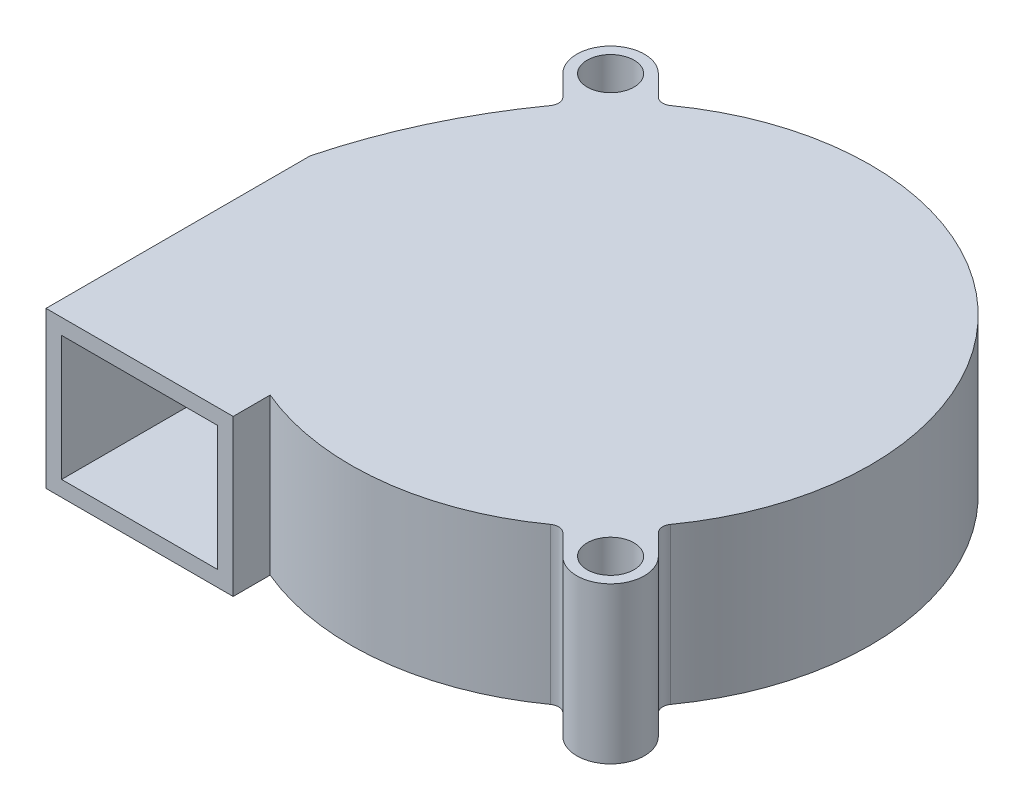
from build123d import *

# Parameters (mm, degrees)
SKETCH1_R            = 2.25
BOSS_EXTRUDE1_DEPTH  = 15
SKETCH2_W            = 15
SKETCH2_H            = 12
BLOWER_OPENING_DEPTH = 20


with BuildPart() as part:
    # Sketch1 → Boss-Extrude1 (new body)
    with BuildSketch(Plane(origin=(0, 0, 0), x_dir=(1, 0, 0), z_dir=(0, 1, 0))):
        with BuildLine():
            ThreePointArc((-20.329518762, 14.550280647), (-24.739386117, 7.014235726), (-27.7, -1.2))
            Line((-27.7, -1.2), (-27.7, -26.6))
            Line((-27.7, -26.6), (-9.7, -26.6))
            Line((-9.7, -26.6), (-9.7, -23.041484327))
            ThreePointArc((-9.7, -23.041484327), (2.778487879, -24.845120348), (14.550280647, -20.329518762))
            ThreePointArc((14.550280647, -20.329518762), (15.214298861, -20.146067758), (15.839398654, -20.435592731))
            Line((15.839398654, -20.435592731), (17.801902961, -22.398097039))
            ThreePointArc((17.801902961, -22.398097039), (22.398097039, -22.398097039), (22.398097039, -17.801902961))
            Line((22.398097039, -17.801902961), (20.435592731, -15.839398654))
            ThreePointArc((20.435592731, -15.839398654), (20.146067758, -15.214298861), (20.329518762, -14.550280647))
            ThreePointArc((20.329518762, -14.550280647), (17.67766953, 17.67766953), (-14.550280647, 20.329518762))
            ThreePointArc((-14.550280647, 20.329518762), (-15.214298861, 20.146067758), (-15.839398654, 20.435592731))
            Line((-15.839398654, 20.435592731), (-17.801902961, 22.398097039))
            ThreePointArc((-17.801902961, 22.398097039), (-22.398097039, 22.398097039), (-22.398097039, 17.801902961))
            Line((-22.398097039, 17.801902961), (-20.435592731, 15.839398654))
            ThreePointArc((-20.435592731, 15.839398654), (-20.146067758, 15.214298861), (-20.329518762, 14.550280647))
        make_face()
        with Locations((-20.1, 20.1)):
            Circle(SKETCH1_R, mode=Mode.SUBTRACT)
        with Locations((20.1, -20.1)):
            Circle(SKETCH1_R, mode=Mode.SUBTRACT)
    extrude(amount=BOSS_EXTRUDE1_DEPTH)

    # Sketch2 → blower opening (cut)
    with BuildSketch(Plane.XY.offset(26.6)):
        with Locations((-18.7, 7.5)):
            Rectangle(SKETCH2_W, SKETCH2_H)
    extrude(amount=-BLOWER_OPENING_DEPTH, mode=Mode.SUBTRACT)


solid = part.part
